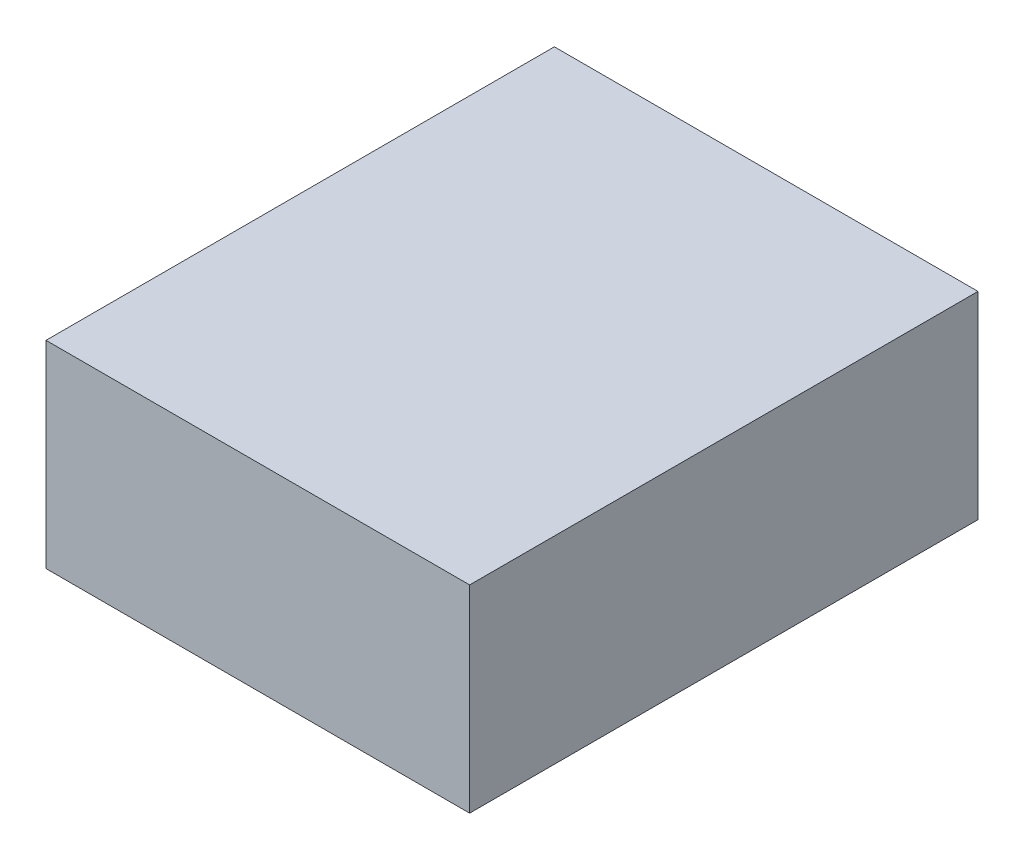
from build123d import *

# Parameters (mm, degrees)
SKETCH2_W           = 150
SKETCH2_H           = 180
BOSS_EXTRUDE1_DEPTH = 70


with BuildPart() as part:
    # Sketch2 → Boss-Extrude1 (new body)
    with BuildSketch(Plane(origin=(0, 0, 0), x_dir=(1, 0, 0), z_dir=(0, 1, 0))):
        Rectangle(SKETCH2_W, SKETCH2_H)
    extrude(amount=BOSS_EXTRUDE1_DEPTH)


solid = part.part
